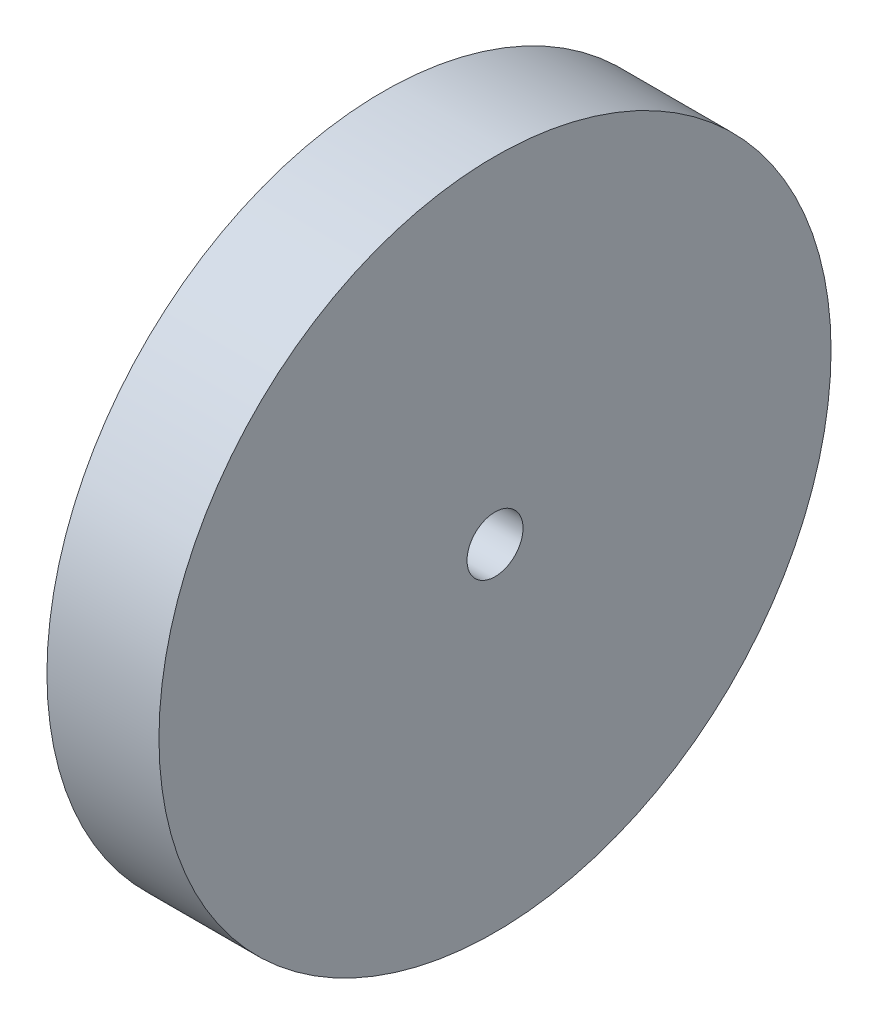
from build123d import *

# Parameters (mm, degrees)
SKETCH1_R           = 38.1
BOSS_EXTRUDE1_DEPTH = 12.7
SKETCH2_R           = 3.175
CUT_EXTRUDE1_DEPTH  = 12.7


with BuildPart() as part:
    # Sketch1 → Boss-Extrude1 (new body)
    with BuildSketch(Plane(origin=(0, 0, 0), x_dir=(0, 0, -1), z_dir=(1, 0, 0))):
        Circle(SKETCH1_R)
    extrude(amount=BOSS_EXTRUDE1_DEPTH)

    # Sketch2 → Cut-Extrude1 (cut)
    with BuildSketch(Plane(origin=(12.7, 0, 0), x_dir=(0, 0, -1), z_dir=(1, 0, 0))):
        Circle(SKETCH2_R)
    extrude(amount=-CUT_EXTRUDE1_DEPTH, mode=Mode.SUBTRACT)


solid = part.part
